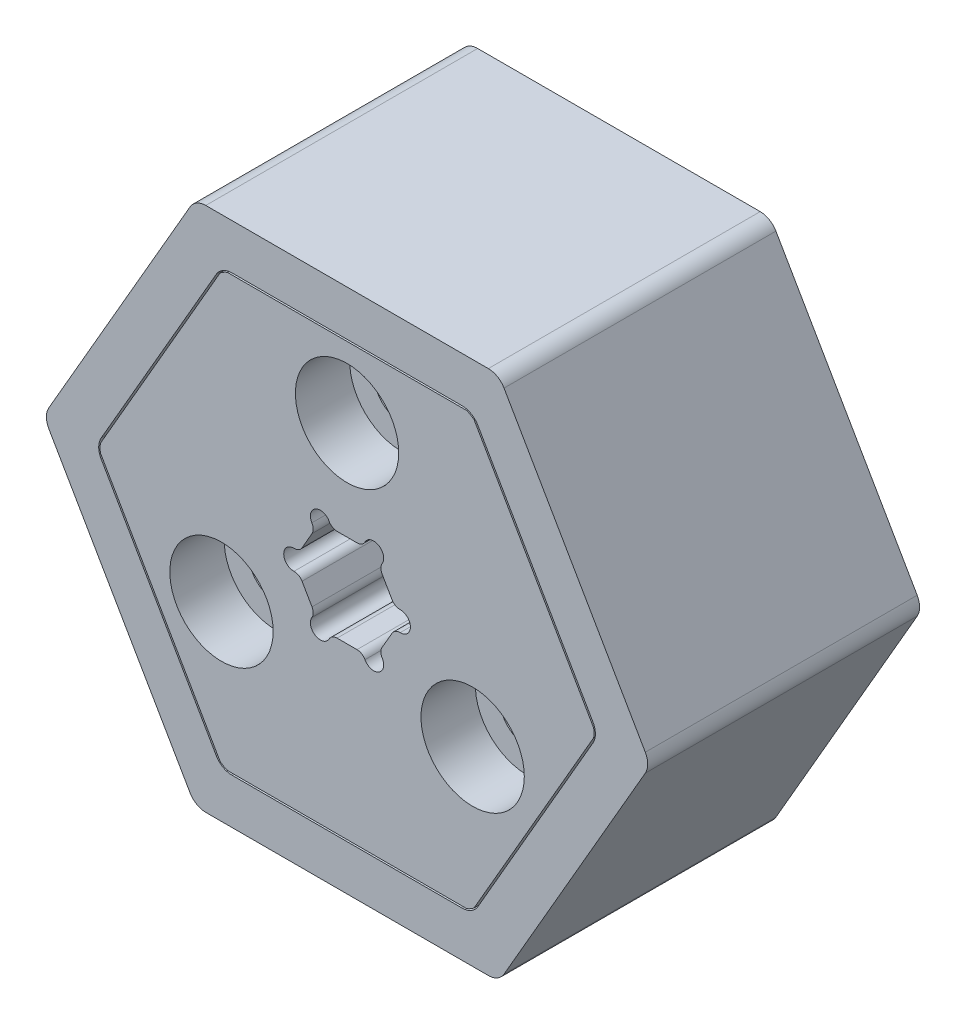
from build123d import *

# Parameters (mm, degrees)
SKETCH_1_R          = 1.5
EXTRUDE_1_DEPTH     = 2
EXTRUDE_2_DEPTH     = 13
EXTRUDE_3_DEPTH     = 3
EXTRUDE_4_DEPTH     = 10
SKETCH_8_R          = 3.75
CUT_EXTRUDE_2_DEPTH = 10
FILLET_1_R          = 1
FILLET_2_R          = 1.5
SKETCH_9_R          = 0.55
CUT_EXTRUDE_3_DEPTH = 10
FILLET_3_R          = 0.5
SKETCH_10_R         = 1.25
CUT_EXTRUDE_4_DEPTH = 10
SKETCH_11_R         = 1.25
CUT_EXTRUDE_5_DEPTH = 5
SKETCH_12_R         = 1.5
EXTRUDE_5_DEPTH     = 5
SKETCH_14_R         = 2.85
CUT_EXTRUDE_6_DEPTH = 3
CUT_EXTRUDE_8_DEPTH = 20


with BuildPart() as part:
    # 草图1 → 凸台-拉伸1 (new body)
    # profile 1 of 2: a face of its own
    with BuildSketch(Plane.XY):
        Polygon((8.371578903, -14.5), (16.743157806, 0), (8.371578903, 14.5), (-8.371578903, 14.5), (-16.743157806, 0), (-8.371578903, -14.5), align=None)
        Polygon((14.43375673, 0), (7.216878365, 12.5), (-7.216878365, 12.5), (-14.43375673, 0), (-7.216878365, -12.5), (7.216878365, -12.5), align=None, mode=Mode.SUBTRACT)
    # profile 2 of 2: a face of its own
    with BuildSketch(Plane.XY):
        Polygon((7.216878365, -12.5), (14.43375673, 0), (7.216878365, 12.5), (-7.216878365, 12.5), (-14.43375673, 0), (-7.216878365, -12.5), align=None)
        with Locations((0, -6.5)):
            Circle(SKETCH_1_R, mode=Mode.SUBTRACT)
        with Locations((0, 6.5)):
            Circle(SKETCH_1_R, mode=Mode.SUBTRACT)
    extrude(amount=EXTRUDE_1_DEPTH)

    # 草图3 → 凸台-拉伸2 (add)
    with BuildSketch(Plane.XY.offset(2)):
        Polygon((8.371578903, -14.5), (16.743157806, 0), (8.371578903, 14.5), (-8.371578903, 14.5), (-16.743157806, 0), (-8.371578903, -14.5), align=None)
        Polygon((6.92820323, 12), (-6.92820323, 12), (-13.856406461, 0), (-6.92820323, -12), (6.92820323, -12), (13.856406461, 0), align=None, mode=Mode.SUBTRACT)
    extrude(amount=EXTRUDE_2_DEPTH)

    # 草图4 → 凸台-拉伸3 (add)
    with BuildSketch(Plane.XY.offset(2)):
        Polygon((13.856406461, 0), (6.92820323, 12), (-6.92820323, 12), (-13.856406461, 0), (-6.92820323, -12), (6.92820323, -12), align=None)
        with BuildLine():
            Line((3, 6.5), (3, -6.5))
            ThreePointArc((3, -6.5), (0, -9.5), (-3, -6.5))
            Line((-3, -6.5), (-3, 6.5))
            ThreePointArc((-3, 6.5), (0, 9.5), (3, 6.5))
        make_face(mode=Mode.SUBTRACT)
    extrude(amount=EXTRUDE_3_DEPTH)

    # 草图8 → 切除-拉伸2 (cut)
    with BuildSketch(Plane(origin=(0, 0, 0), x_dir=(-1, 0, 0), z_dir=(0, 0, -1))):
        Circle(SKETCH_8_R)
    extrude(amount=-CUT_EXTRUDE_2_DEPTH, mode=Mode.SUBTRACT)

    # 圆角1
    fillet_1_edges = [part.edges().sort_by_distance(p)[0] for p in [
        (-3, 2.25, 3.5),
        (-3, -2.25, 3.5),
        (8.371578903, -14.5, 7.5),
        (-8.371578903, -14.5, 7.5),
        (-16.743157806, 0, 7.5),
        (-8.371578903, 14.5, 7.5),
        (8.371578903, 14.5, 7.5),
        (16.743157806, 0, 7.5),
        (6.92820323, 12, 10),
        (-6.92820323, 12, 10),
        (-13.856406461, 0, 10),
        (-6.92820323, -12, 10),
        (6.92820323, -12, 10),
        (13.856406461, 0, 10),
        (3, -2.25, 3.5),
        (3, 2.25, 3.5),
    ]]
    fillet(fillet_1_edges, radius=FILLET_1_R)


with BuildPart() as body_2:
    # 草图5 → 凸台-拉伸4 (new body)
    with BuildSketch(Plane.XY.offset(5)):
        Polygon((6.92820323, -12), (13.856406461, 0), (6.92820323, 12), (-6.92820323, 12), (-13.856406461, 0), (-6.92820323, -12), align=None)
        Polygon((1.472243186, 2.55), (-1.472243186, 2.55), (-2.944486373, 0), (-1.472243186, -2.55), (1.472243186, -2.55), (2.944486373, 0), align=None, mode=Mode.SUBTRACT)
    extrude(amount=EXTRUDE_4_DEPTH)

    # 圆角2
    fillet_2_edges = [body_2.edges().sort_by_distance(p)[0] for p in [
        (-6.92820323, -12, 10),
        (-13.856406461, 0, 10),
        (-6.92820323, 12, 10),
        (6.92820323, 12, 10),
        (13.856406461, 0, 10),
        (6.92820323, -12, 10),
    ]]
    fillet(fillet_2_edges, radius=FILLET_2_R)

    # 草图9 → 切除-拉伸3 (cut)
    with BuildSketch(Plane.XY.offset(15)):
        with Locations((1.472243186, 2.55)):
            Circle(SKETCH_9_R)
        with Locations((2.944486373, 0)):
            Circle(SKETCH_9_R)
        with Locations((1.472243186, -2.55)):
            Circle(SKETCH_9_R)
        with Locations((-1.472243186, -2.55)):
            Circle(SKETCH_9_R)
        with Locations((-2.944486373, 0)):
            Circle(SKETCH_9_R)
        with Locations((-1.472243186, 2.55)):
            Circle(SKETCH_9_R)
    extrude(amount=-CUT_EXTRUDE_3_DEPTH, mode=Mode.SUBTRACT)

    # 圆角3
    fillet_3_edges = [body_2.edges().sort_by_distance(p)[0] for p in [
        (-0.922243186, 2.55, 10),
        (-2.669486373, 0.476313972, 10),
        (-1.747243186, -2.073686028, 10),
        (0.922243186, -2.55, 10),
        (2.669486373, 0.476313972, 10),
        (1.747243186, 2.073686028, 10),
        (2.669486373, -0.476313972, 10),
        (1.747243186, -2.073686028, 10),
        (-0.922243186, -2.55, 10),
        (-2.669486373, -0.476313972, 10),
        (-1.747243186, 2.073686028, 10),
        (0.922243186, 2.55, 10),
    ]]
    fillet(fillet_3_edges, radius=FILLET_3_R)

    # 草图10 → 切除-拉伸4 (cut)
    with BuildSketch(Plane.XY.offset(15)):
        with Locations((0, 8)):
            Circle(SKETCH_10_R)
        with Locations((6.92820323, -4)):
            Circle(SKETCH_10_R)
        with Locations((-6.92820323, -4)):
            Circle(SKETCH_10_R)
    extrude(amount=-CUT_EXTRUDE_4_DEPTH, mode=Mode.SUBTRACT)

    # 草图11 → 切除-拉伸5 (cut)
    with BuildSketch(Plane.XY.offset(15)):
        with BuildLine():
            Line((-13.423393759, -0.75), (-7.361215932, -11.25))
            ThreePointArc((-7.361215932, -11.25), (-6.812177826, -11.799038106), (-6.062177826, -12))
            Line((-6.062177826, -12), (6.062177826, -12))
            ThreePointArc((6.062177826, -12), (6.812177826, -11.799038106), (7.361215932, -11.25))
            Line((7.361215932, -11.25), (13.423393759, -0.75))
            ThreePointArc((13.423393759, -0.75), (13.624355653, 0), (13.423393759, 0.75))
            Line((13.423393759, 0.75), (7.361215932, 11.25))
            ThreePointArc((7.361215932, 11.25), (6.812177826, 11.799038106), (6.062177826, 12))
            Line((6.062177826, 12), (-6.062177826, 12))
            ThreePointArc((-6.062177826, 12), (-6.812177826, 11.799038106), (-7.361215932, 11.25))
            Line((-7.361215932, 11.25), (-13.423393759, 0.75))
            ThreePointArc((-13.423393759, 0.75), (-13.624355653, 0), (-13.423393759, -0.75))
        make_face()
        with Locations((-6.92820323, -4)):
            Circle(SKETCH_11_R, mode=Mode.SUBTRACT)
        with Locations((6.92820323, -4)):
            Circle(SKETCH_11_R, mode=Mode.SUBTRACT)
        with Locations((0, 8)):
            Circle(SKETCH_11_R, mode=Mode.SUBTRACT)
        with BuildLine():
            Line((0.548933921, 2.55), (-0.548933921, 2.55))
            ThreePointArc((-0.548933921, 2.55), (-0.804817079, 2.620437654), (-0.988605, 2.811904762))
            ThreePointArc((-0.988605, 2.811904762), (-1.747243186, 3.026313972), (-1.940878457, 2.262109425))
            ThreePointArc((-1.940878457, 2.262109425), (-1.866957038, 2.007210862), (-1.933897819, 1.75039072))
            Line((-1.933897819, 1.75039072), (-2.48283174, 0.79960928))
            ThreePointArc((-2.48283174, 0.79960928), (-2.671774116, 0.613226791), (-2.929483457, 0.549795337))
            ThreePointArc((-2.929483457, 0.549795337), (-3.494486373, 0), (-2.929483457, -0.549795337))
            ThreePointArc((-2.929483457, -0.549795337), (-2.671774116, -0.613226791), (-2.48283174, -0.79960928))
            Line((-2.48283174, -0.79960928), (-1.933897819, -1.75039072))
            ThreePointArc((-1.933897819, -1.75039072), (-1.866957038, -2.007210862), (-1.940878457, -2.262109425))
            ThreePointArc((-1.940878457, -2.262109425), (-1.747243186, -3.026313972), (-0.988605, -2.811904762))
            ThreePointArc((-0.988605, -2.811904762), (-0.804817079, -2.620437654), (-0.548933921, -2.55))
            Line((-0.548933921, -2.55), (0.548933921, -2.55))
            ThreePointArc((0.548933921, -2.55), (0.804817079, -2.620437654), (0.988605, -2.811904762))
            ThreePointArc((0.988605, -2.811904762), (1.747243186, -3.026313972), (1.940878457, -2.262109425))
            ThreePointArc((1.940878457, -2.262109425), (1.866957038, -2.007210862), (1.933897819, -1.75039072))
            Line((1.933897819, -1.75039072), (2.48283174, -0.79960928))
            ThreePointArc((2.48283174, -0.79960928), (2.671774116, -0.613226791), (2.929483457, -0.549795337))
            ThreePointArc((2.929483457, -0.549795337), (3.494486373, 0), (2.929483457, 0.549795337))
            ThreePointArc((2.929483457, 0.549795337), (2.671774116, 0.613226791), (2.48283174, 0.79960928))
            Line((2.48283174, 0.79960928), (1.933897819, 1.75039072))
            ThreePointArc((1.933897819, 1.75039072), (1.866957038, 2.007210862), (1.940878457, 2.262109425))
            ThreePointArc((1.940878457, 2.262109425), (1.747243186, 3.026313972), (0.988605, 2.811904762))
            ThreePointArc((0.988605, 2.811904762), (0.804817079, 2.620437654), (0.548933921, 2.55))
        make_face(mode=Mode.SUBTRACT)
    extrude(amount=-CUT_EXTRUDE_5_DEPTH, mode=Mode.SUBTRACT)


with BuildPart() as body_3:
    # 草图12 → 凸台-拉伸5 (new body)
    with BuildSketch(Plane.XY.offset(10)):
        with BuildLine():
            Line((-13.423393759, -0.75), (-7.361215932, -11.25))
            ThreePointArc((-7.361215932, -11.25), (-6.812177826, -11.799038106), (-6.062177826, -12))
            Line((-6.062177826, -12), (6.062177826, -12))
            ThreePointArc((6.062177826, -12), (6.812177826, -11.799038106), (7.361215932, -11.25))
            Line((7.361215932, -11.25), (13.423393759, -0.75))
            ThreePointArc((13.423393759, -0.75), (13.624355653, 0), (13.423393759, 0.75))
            Line((13.423393759, 0.75), (7.361215932, 11.25))
            ThreePointArc((7.361215932, 11.25), (6.812177826, 11.799038106), (6.062177826, 12))
            Line((6.062177826, 12), (-6.062177826, 12))
            ThreePointArc((-6.062177826, 12), (-6.812177826, 11.799038106), (-7.361215932, 11.25))
            Line((-7.361215932, 11.25), (-13.423393759, 0.75))
            ThreePointArc((-13.423393759, 0.75), (-13.624355653, 0), (-13.423393759, -0.75))
        make_face()
        with Locations((0, 8)):
            Circle(SKETCH_12_R, mode=Mode.SUBTRACT)
        with Locations((6.92820323, -4)):
            Circle(SKETCH_12_R, mode=Mode.SUBTRACT)
        with Locations((-6.92820323, -4)):
            Circle(SKETCH_12_R, mode=Mode.SUBTRACT)
        with BuildLine():
            Line((0.548933921, 2.55), (-0.548933921, 2.55))
            ThreePointArc((-0.548933921, 2.55), (-0.804817079, 2.620437654), (-0.988605, 2.811904762))
            ThreePointArc((-0.988605, 2.811904762), (-1.747243186, 3.026313972), (-1.940878457, 2.262109425))
            ThreePointArc((-1.940878457, 2.262109425), (-1.866957038, 2.007210862), (-1.933897819, 1.75039072))
            Line((-1.933897819, 1.75039072), (-2.48283174, 0.79960928))
            ThreePointArc((-2.48283174, 0.79960928), (-2.671774116, 0.613226791), (-2.929483457, 0.549795337))
            ThreePointArc((-2.929483457, 0.549795337), (-3.494486373, 0), (-2.929483457, -0.549795337))
            ThreePointArc((-2.929483457, -0.549795337), (-2.671774116, -0.613226791), (-2.48283174, -0.79960928))
            Line((-2.48283174, -0.79960928), (-1.933897819, -1.75039072))
            ThreePointArc((-1.933897819, -1.75039072), (-1.866957038, -2.007210862), (-1.940878457, -2.262109425))
            ThreePointArc((-1.940878457, -2.262109425), (-1.747243186, -3.026313972), (-0.988605, -2.811904762))
            ThreePointArc((-0.988605, -2.811904762), (-0.804817079, -2.620437654), (-0.548933921, -2.55))
            Line((-0.548933921, -2.55), (0.548933921, -2.55))
            ThreePointArc((0.548933921, -2.55), (0.804817079, -2.620437654), (0.988605, -2.811904762))
            ThreePointArc((0.988605, -2.811904762), (1.747243186, -3.026313972), (1.940878457, -2.262109425))
            ThreePointArc((1.940878457, -2.262109425), (1.866957038, -2.007210862), (1.933897819, -1.75039072))
            Line((1.933897819, -1.75039072), (2.48283174, -0.79960928))
            ThreePointArc((2.48283174, -0.79960928), (2.671774116, -0.613226791), (2.929483457, -0.549795337))
            ThreePointArc((2.929483457, -0.549795337), (3.494486373, 0), (2.929483457, 0.549795337))
            ThreePointArc((2.929483457, 0.549795337), (2.671774116, 0.613226791), (2.48283174, 0.79960928))
            Line((2.48283174, 0.79960928), (1.933897819, 1.75039072))
            ThreePointArc((1.933897819, 1.75039072), (1.866957038, 2.007210862), (1.940878457, 2.262109425))
            ThreePointArc((1.940878457, 2.262109425), (1.747243186, 3.026313972), (0.988605, 2.811904762))
            ThreePointArc((0.988605, 2.811904762), (0.804817079, 2.620437654), (0.548933921, 2.55))
        make_face(mode=Mode.SUBTRACT)
    extrude(amount=EXTRUDE_5_DEPTH)

    # 草图14 → 切除-拉伸6 (cut)
    with BuildSketch(Plane.XY.offset(15)):
        with Locations((0, 8)):
            Circle(SKETCH_14_R)
        with Locations((6.92820323, -4)):
            Circle(SKETCH_14_R)
        with Locations((-6.92820323, -4)):
            Circle(SKETCH_14_R)
    extrude(amount=-CUT_EXTRUDE_6_DEPTH, mode=Mode.SUBTRACT)


with BuildPart() as cut_extrude_8_tool:
    # 草图16 → 切除-拉伸8 (new body)
    with BuildSketch(Plane.XY.offset(15)):
        with BuildLine():
            Line((-13.606049459, 0.233631047), (-7.005355151, 11.666368953))
            ThreePointArc((-7.005355151, 11.666368953), (-7.202451165, 11.474564885), (-7.361215932, 11.25))
            Line((-7.361215932, 11.25), (-13.423393759, 0.75))
            ThreePointArc((-13.423393759, 0.75), (-13.53849027, 0.500223236), (-13.606049459, 0.233631047))
        make_face()
        with BuildLine():
            Line((-7.005355151, -11.666368953), (-13.606049459, -0.233631047))
            ThreePointArc((-13.606049459, -0.233631047), (-13.53849027, -0.500223236), (-13.423393759, -0.75))
            Line((-13.423393759, -0.75), (-7.361215932, -11.25))
            ThreePointArc((-7.361215932, -11.25), (-7.202451165, -11.474564885), (-7.005355151, -11.666368953))
        make_face()
        with BuildLine():
            ThreePointArc((6.062177826, -12), (6.336039105, -11.97478812), (6.600694307, -11.9))
            Line((6.600694307, -11.9), (-6.600694307, -11.9))
            ThreePointArc((-6.600694307, -11.9), (-6.336039105, -11.97478812), (-6.062177826, -12))
            Line((-6.062177826, -12), (6.062177826, -12))
        make_face()
        with BuildLine():
            ThreePointArc((13.423393759, -0.75), (13.53849027, -0.500223236), (13.606049459, -0.233631047))
            Line((13.606049459, -0.233631047), (7.005355151, -11.666368953))
            ThreePointArc((7.005355151, -11.666368953), (7.202451165, -11.474564885), (7.361215932, -11.25))
            Line((7.361215932, -11.25), (13.423393759, -0.75))
        make_face()
        with BuildLine():
            ThreePointArc((7.361215932, 11.25), (7.202451165, 11.474564885), (7.005355151, 11.666368953))
            Line((7.005355151, 11.666368953), (13.606049459, 0.233631047))
            ThreePointArc((13.606049459, 0.233631047), (13.53849027, 0.500223236), (13.423393759, 0.75))
            Line((13.423393759, 0.75), (7.361215932, 11.25))
        make_face()
        with BuildLine():
            Line((-6.600694307, 11.9), (6.600694307, 11.9))
            ThreePointArc((6.600694307, 11.9), (6.336039105, 11.97478812), (6.062177826, 12))
            Line((6.062177826, 12), (-6.062177826, 12))
            ThreePointArc((-6.062177826, 12), (-6.336039105, 11.97478812), (-6.600694307, 11.9))
        make_face()
    extrude(amount=-CUT_EXTRUDE_8_DEPTH)


with BuildPart() as body_2_1:
    add(body_2.part)

    # 切除-拉伸8: cut by cut_extrude_8_tool
    add(cut_extrude_8_tool.part, mode=Mode.SUBTRACT)


with BuildPart() as body_3_1:
    add(body_3.part)

    # 切除-拉伸8: cut by cut_extrude_8_tool
    add(cut_extrude_8_tool.part, mode=Mode.SUBTRACT)


solid = Compound([part.part, body_2_1.part, body_3_1.part])
